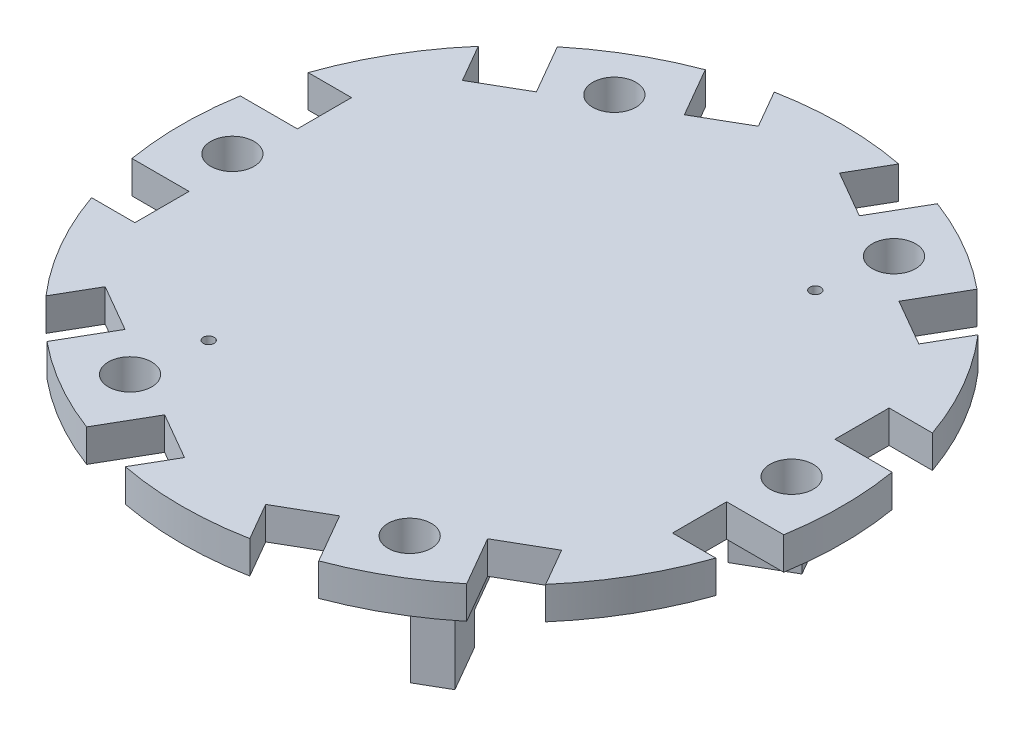
from build123d import *

# Parameters (mm, degrees)
CROQUIS1_R              = 30.5
SALIENTE_EXTRUIR1_DEPTH = 3
CORTAR_EXTRUIR3_START   = -4
CORTAR_EXTRUIR3_DEPTH   = 4
CORTAR_EXTRUIR4_DEPTH   = 10
CROQUIS8_R              = 0.5
CORTAR_EXTRUIR5_DEPTH   = 3
SALIENTE_EXTRUIR2_DEPTH = 13
SALIENTE_EXTRUIR3_DEPTH = 3
REDONDEO1_R             = 1


with BuildPart() as part:
    # Croquis1 → Saliente-Extruir1 (new body)
    with BuildSketch(Plane(origin=(0, 0, 0), x_dir=(1, 0, 0), z_dir=(0, 1, 0))):
        with Locations(Location((0, 0, 0), (0, 0, 270))):
            Circle(CROQUIS1_R)
    extrude(amount=SALIENTE_EXTRUIR1_DEPTH)

    # Croquis5 → Cortar-Extruir3 (cut)
    with BuildSketch(Plane(origin=(0, 3, 0), x_dir=(1, 0, 0), z_dir=(0, 1, 0)).offset(CORTAR_EXTRUIR3_START)):
        with BuildLine():
            ThreePointArc((-28.814059068, 10), (-29.556634924, 7.526973624), (-30.087372767, 5))
            Line((-30.087372767, 5), (-28.814059068, 5))
            Line((-28.814059068, 5), (-24.814059068, 5))
            Line((-24.814059068, 5), (-24.814059068, 10))
            Line((-24.814059068, 10), (-28.814059068, 10))
        make_face()
        with BuildLine():
            Line((28.814059068, 5), (30.087372767, 5))
            ThreePointArc((30.087372767, 5), (29.556634924, 7.526973624), (28.814059068, 10))
            Line((28.814059068, 10), (24.814059068, 10))
            Line((24.814059068, 10), (24.814059068, 5))
            Line((24.814059068, 5), (28.814059068, 5))
        make_face()
        with BuildLine():
            Line((30.087372767, -5), (28.814059068, -5))
            Line((28.814059068, -5), (24.814059068, -5))
            Line((24.814059068, -5), (24.814059068, -10))
            Line((24.814059068, -10), (28.814059068, -10))
            ThreePointArc((28.814059068, -10), (29.556634924, -7.526973624), (30.087372767, -5))
        make_face()
        with BuildLine():
            ThreePointArc((19.373813402, -23.556429149), (21.296867835, -21.833309883), (23.067283572, -19.953707139))
            Line((23.067283572, -19.953707139), (21.067283572, -16.489605524))
            Line((21.067283572, -16.489605524), (16.737156553, -18.989605524))
            Line((16.737156553, -18.989605524), (18.737156553, -22.453707139))
            Line((18.737156553, -22.453707139), (19.373813402, -23.556429149))
        make_face()
        with BuildLine():
            ThreePointArc((5.746775496, -29.953707139), (8.25976709, -29.360283507), (10.713559364, -28.556429149))
            Line((10.713559364, -28.556429149), (10.076902515, -27.453707139))
            Line((10.076902515, -27.453707139), (8.076902515, -23.989605524))
            Line((8.076902515, -23.989605524), (3.746775496, -26.489605524))
            Line((3.746775496, -26.489605524), (5.746775496, -29.953707139))
        make_face()
        with BuildLine():
            ThreePointArc((-10.713559364, -28.556429149), (-8.25976709, -29.360283507), (-5.746775496, -29.953707139))
            Line((-5.746775496, -29.953707139), (-3.746775496, -26.489605524))
            Line((-3.746775496, -26.489605524), (-8.076902515, -23.989605524))
            Line((-8.076902515, -23.989605524), (-10.076902515, -27.453707139))
            Line((-10.076902515, -27.453707139), (-10.713559364, -28.556429149))
        make_face()
        with BuildLine():
            ThreePointArc((-23.067283572, -19.953707139), (-21.296867835, -21.833309883), (-19.373813402, -23.556429149))
            Line((-19.373813402, -23.556429149), (-18.737156553, -22.453707139))
            Line((-18.737156553, -22.453707139), (-16.737156553, -18.989605524))
            Line((-16.737156553, -18.989605524), (-21.067283572, -16.489605524))
            Line((-21.067283572, -16.489605524), (-23.067283572, -19.953707139))
        make_face()
        with BuildLine():
            ThreePointArc((-30.087372767, -5), (-29.556634924, -7.526973624), (-28.814059068, -10))
            Line((-28.814059068, -10), (-24.814059068, -10))
            Line((-24.814059068, -10), (-24.814059068, -5))
            Line((-24.814059068, -5), (-28.814059068, -5))
            Line((-28.814059068, -5), (-30.087372767, -5))
        make_face()
        with BuildLine():
            Line((-18.737156553, 22.453707139), (-19.373813402, 23.556429149))
            ThreePointArc((-19.373813402, 23.556429149), (-21.296867835, 21.833309883), (-23.067283572, 19.953707139))
            Line((-23.067283572, 19.953707139), (-21.067283572, 16.489605524))
            Line((-21.067283572, 16.489605524), (-16.737156553, 18.989605524))
            Line((-16.737156553, 18.989605524), (-18.737156553, 22.453707139))
        make_face()
        with BuildLine():
            Line((-3.746775496, 26.489605524), (-5.746775496, 29.953707139))
            ThreePointArc((-5.746775496, 29.953707139), (-8.25976709, 29.360283507), (-10.713559364, 28.556429149))
            Line((-10.713559364, 28.556429149), (-10.076902515, 27.453707139))
            Line((-10.076902515, 27.453707139), (-8.076902515, 23.989605524))
            Line((-8.076902515, 23.989605524), (-3.746775496, 26.489605524))
        make_face()
        with BuildLine():
            Line((10.076902515, 27.453707139), (10.713559364, 28.556429149))
            ThreePointArc((10.713559364, 28.556429149), (8.25976709, 29.360283507), (5.746775496, 29.953707139))
            Line((5.746775496, 29.953707139), (3.746775496, 26.489605524))
            Line((3.746775496, 26.489605524), (8.076902515, 23.989605524))
            Line((8.076902515, 23.989605524), (10.076902515, 27.453707139))
        make_face()
        with BuildLine():
            Line((21.067283572, 16.489605524), (23.067283572, 19.953707139))
            ThreePointArc((23.067283572, 19.953707139), (21.296867835, 21.833309883), (19.373813402, 23.556429149))
            Line((19.373813402, 23.556429149), (18.737156553, 22.453707139))
            Line((18.737156553, 22.453707139), (16.737156553, 18.989605524))
            Line((16.737156553, 18.989605524), (21.067283572, 16.489605524))
        make_face()
    extrude(amount=CORTAR_EXTRUIR3_DEPTH, mode=Mode.SUBTRACT)

    # Croquis7 → Cortar-Extruir4 (cut)
    with BuildSketch(Plane(origin=(0, 3, 0), x_dir=(1, 0, 0), z_dir=(0, 1, 0))):
        with BuildLine():
            ThreePointArc((-13.907029535, 20.623580122), (-11.907029535, 20.623580122), (-10.907029535, 22.355630929))
            Line((-10.907029535, 22.355630929), (-12.907029535, 22.355630929))
            Line((-12.907029535, 22.355630929), (-13.907029535, 20.623580122))
        make_face()
        with BuildLine():
            Line((-12.907029535, 22.355630929), (-10.907029535, 22.355630929))
            ThreePointArc((-10.907029535, 22.355630929), (-13.907029535, 24.087681737), (-13.907029535, 20.623580122))
            Line((-13.907029535, 20.623580122), (-12.907029535, 22.355630929))
        make_face()
        with BuildLine():
            ThreePointArc((-23.81405907, 0), (-24.082008262, 1), (-24.81405907, 1.732050808))
            Line((-24.81405907, 1.732050808), (-25.81405907, 0))
            Line((-25.81405907, 0), (-24.81405907, -1.732050808))
            ThreePointArc((-24.81405907, -1.732050808), (-24.082008262, -1), (-23.81405907, 0))
        make_face()
        with BuildLine():
            Line((-25.81405907, 0), (-24.81405907, 1.732050808))
            ThreePointArc((-24.81405907, 1.732050808), (-27.81405907, 0), (-24.81405907, -1.732050808))
            Line((-24.81405907, -1.732050808), (-25.81405907, 0))
        make_face()
        with BuildLine():
            ThreePointArc((10.907029535, 22.355630929), (11.907029535, 20.623580122), (13.907029535, 20.623580122))
            Line((13.907029535, 20.623580122), (12.907029535, 22.355630929))
            Line((12.907029535, 22.355630929), (10.907029535, 22.355630929))
        make_face()
        with BuildLine():
            Line((12.907029535, 22.355630929), (13.907029535, 20.623580122))
            ThreePointArc((13.907029535, 20.623580122), (14.639080343, 21.355630929), (14.907029535, 22.355630929))
            ThreePointArc((14.907029535, 22.355630929), (12.907029535, 24.355630929), (10.907029535, 22.355630929))
            Line((10.907029535, 22.355630929), (12.907029535, 22.355630929))
        make_face()
        with BuildLine():
            Line((24.81405907, -1.732050808), (25.81405907, 0))
            Line((25.81405907, 0), (24.81405907, 1.732050808))
            ThreePointArc((24.81405907, 1.732050808), (23.81405907, 0), (24.81405907, -1.732050808))
        make_face()
        with BuildLine():
            Line((24.81405907, 1.732050808), (25.81405907, 0))
            Line((25.81405907, 0), (24.81405907, -1.732050808))
            ThreePointArc((24.81405907, -1.732050808), (26.81405907, -1.732050808), (27.81405907, 0))
            ThreePointArc((27.81405907, 0), (26.81405907, 1.732050808), (24.81405907, 1.732050808))
        make_face()
        with BuildLine():
            ThreePointArc((-13.907029535, -20.623580122), (-13.907029535, -24.087681737), (-10.907029535, -22.355630929))
            Line((-10.907029535, -22.355630929), (-12.907029535, -22.355630929))
            Line((-12.907029535, -22.355630929), (-13.907029535, -20.623580122))
        make_face()
        with BuildLine():
            Line((-12.907029535, -22.355630929), (-10.907029535, -22.355630929))
            ThreePointArc((-10.907029535, -22.355630929), (-11.907029535, -20.623580122), (-13.907029535, -20.623580122))
            Line((-13.907029535, -20.623580122), (-12.907029535, -22.355630929))
        make_face()
        with BuildLine():
            ThreePointArc((14.907029535, -22.355630929), (14.639080343, -21.355630929), (13.907029535, -20.623580122))
            Line((13.907029535, -20.623580122), (12.907029535, -22.355630929))
            Line((12.907029535, -22.355630929), (10.907029535, -22.355630929))
            ThreePointArc((10.907029535, -22.355630929), (12.907029535, -24.355630929), (14.907029535, -22.355630929))
        make_face()
        with BuildLine():
            Line((12.907029535, -22.355630929), (13.907029535, -20.623580122))
            ThreePointArc((13.907029535, -20.623580122), (11.907029535, -20.623580122), (10.907029535, -22.355630929))
            Line((10.907029535, -22.355630929), (12.907029535, -22.355630929))
        make_face()
    extrude(amount=-CORTAR_EXTRUIR4_DEPTH, mode=Mode.SUBTRACT)

    # Croquis8 → Cortar-Extruir5 (cut)
    with BuildSketch(Plane(origin=(0, 3, 0), x_dir=(1, 0, 0), z_dir=(0, 1, 0))):
        with Locations(Location((12, 16, 0), (0, 0, 270))):
            Circle(CROQUIS8_R)
        with Locations(Location((-12, -16, 0), (0, 0, 270))):
            Circle(CROQUIS8_R)
    extrude(amount=-CORTAR_EXTRUIR5_DEPTH, mode=Mode.SUBTRACT)

    # Croquis9 → Saliente-Extruir2 (add)
    with BuildSketch(Plane(origin=(0, 3, 0), x_dir=(1, 0, 0), z_dir=(0, 1, 0))):
        Polygon((-0.549038106, -2.049038106), (-2.049038106, 0.549038106), (-18.070508076, -8.700961894), (-17.320508076, -10), (-16.570508076, -11.299038106), align=None)
        Polygon((2.049038106, -0.549038106), (0.549038106, 2.049038106), (-2.049038106, 0.549038106), (-0.549038106, -2.049038106), align=None)
        Polygon((-2.049038106, 0.549038106), (0.549038106, 2.049038106), (-8.700961894, 18.070508076), (-10, 17.320508076), (-11.299038106, 16.570508076), align=None)
        Polygon((17.320508076, 10), (16.570508076, 11.299038106), (0.549038106, 2.049038106), (2.049038106, -0.549038106), (18.070508076, 8.700961894), align=None)
        Polygon((11.299038106, -16.570508076), (2.049038106, -0.549038106), (-0.549038106, -2.049038106), (8.700961894, -18.070508076), (10, -17.320508076), align=None)
    extrude(amount=-SALIENTE_EXTRUIR2_DEPTH)

    # Croquis10 → Saliente-Extruir3 (add)
    with BuildSketch(Plane(origin=(0, -10, 0), x_dir=(-1, 0, 0), z_dir=(0, -1, 0))):
        Polygon((8.700961894, 18.070508076), (11.299038106, 16.570508076), (8.799038106, 12.240381057), (6.200961894, 13.740381057), align=None)
        Polygon((-12.240381057, 8.799038106), (-13.740381057, 6.200961894), (-18.070508076, 8.700961894), (-16.570508076, 11.299038106), align=None)
        Polygon((-8.700961894, -18.070508076), (-11.299038106, -16.570508076), (-8.799038106, -12.240381057), (-6.200961894, -13.740381057), align=None)
        Polygon((12.240381057, -8.799038106), (13.740381057, -6.200961894), (18.070508076, -8.700961894), (16.570508076, -11.299038106), align=None)
    extrude(amount=SALIENTE_EXTRUIR3_DEPTH)

    # Redondeo1
    redondeo1_edges = [part.edges().sort_by_distance(p)[0] for p in [
        (-8.559773091, 0, 6.674038106),
        (4.075961894, 0, 10.059773091),
        (10, 0, 17.320508076),
        (6.674038106, 0, 8.559773091),
        (10.059773091, 0, -4.075961894),
        (17.320508076, 0, -10),
        (8.559773091, 0, -6.674038106),
        (-4.075961894, 0, -10.059773091),
        (-10, 0, -17.320508076),
        (-6.674038106, 0, -8.559773091),
        (-10.059773091, 0, 4.075961894),
        (-17.320508076, 0, 10),
    ]]
    fillet(redondeo1_edges, radius=REDONDEO1_R)


solid = part.part
